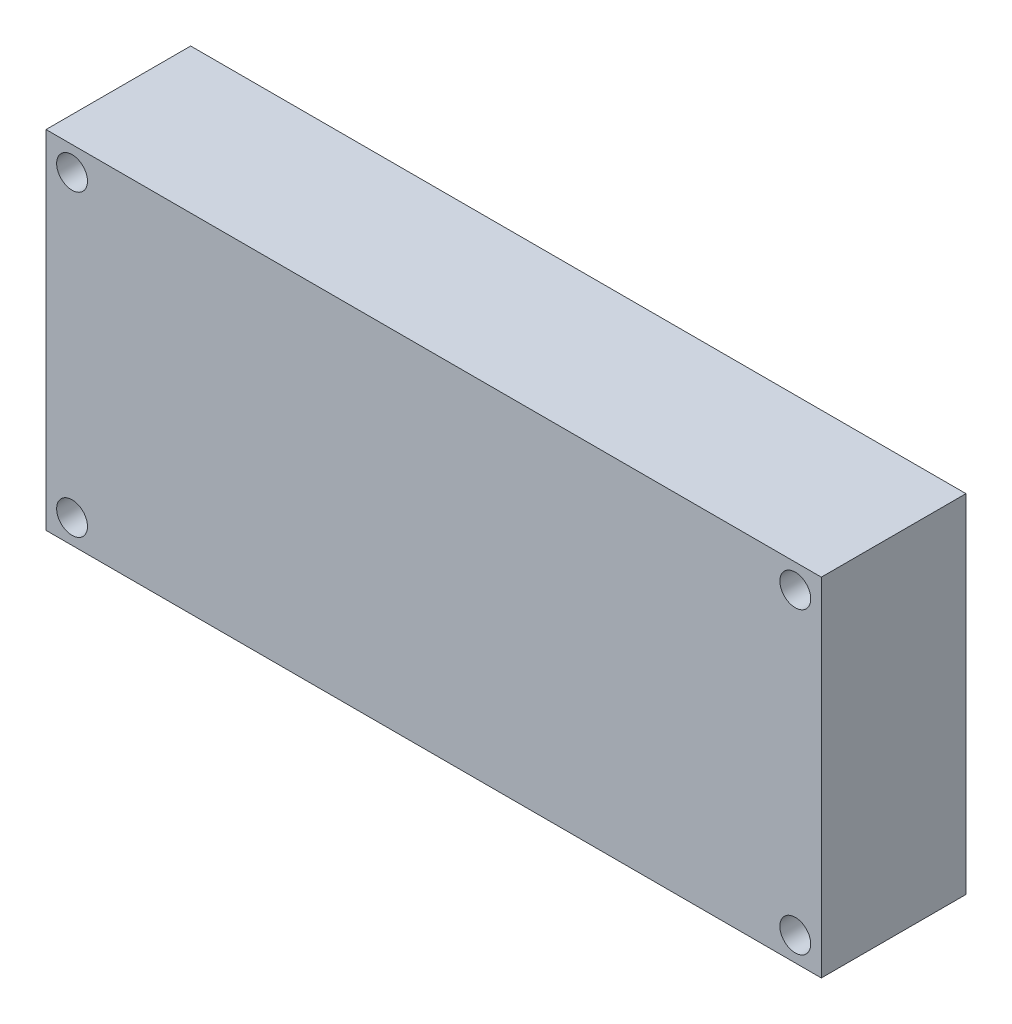
from build123d import *

# Parameters (mm, degrees)
SKETCH_1_W      = 80.4
SKETCH_1_H      = 36
SKETCH_1_R      = 1.6
EXTRUDE_1_DEPTH = 15


with BuildPart() as part:
    # 草圖1 → 伸長1 (new body)
    with BuildSketch(Plane.XY):
        Rectangle(SKETCH_1_W, SKETCH_1_H)
        with Locations((-37.5, 15.5)):
            Circle(SKETCH_1_R, mode=Mode.SUBTRACT)
        with Locations((-37.5, -15.5)):
            Circle(SKETCH_1_R, mode=Mode.SUBTRACT)
        with Locations((37.5, -15.5)):
            Circle(SKETCH_1_R, mode=Mode.SUBTRACT)
        with Locations((37.5, 15.5)):
            Circle(SKETCH_1_R, mode=Mode.SUBTRACT)
    extrude(amount=EXTRUDE_1_DEPTH)


solid = part.part
